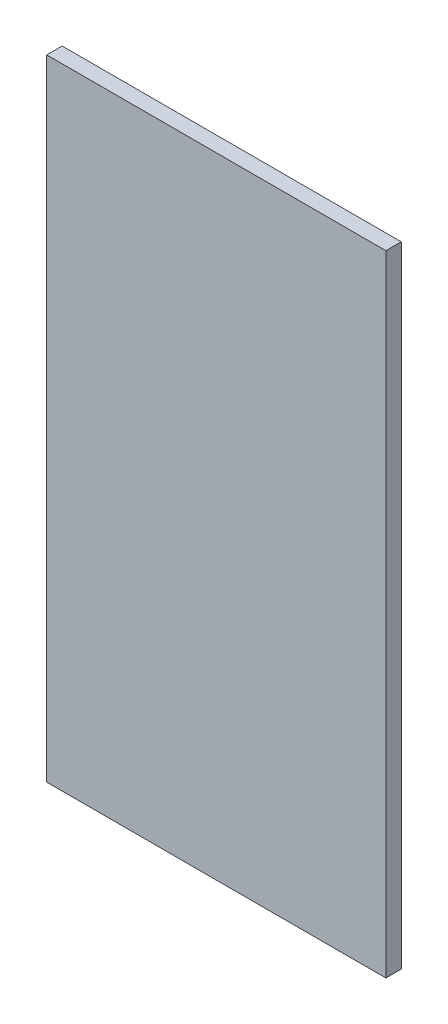
from build123d import *

# Parameters (mm, degrees)
SKETCH1_W           = 35
SKETCH1_H           = 65
BOSS_EXTRUDE1_DEPTH = 1.5875


with BuildPart() as part:
    # Sketch1 → Boss-Extrude1 (new body)
    with BuildSketch(Plane.XY):
        with Locations((-32.500008257, 34.999999019)):
            Rectangle(SKETCH1_W, SKETCH1_H)
    extrude(amount=BOSS_EXTRUDE1_DEPTH)


solid = part.part
